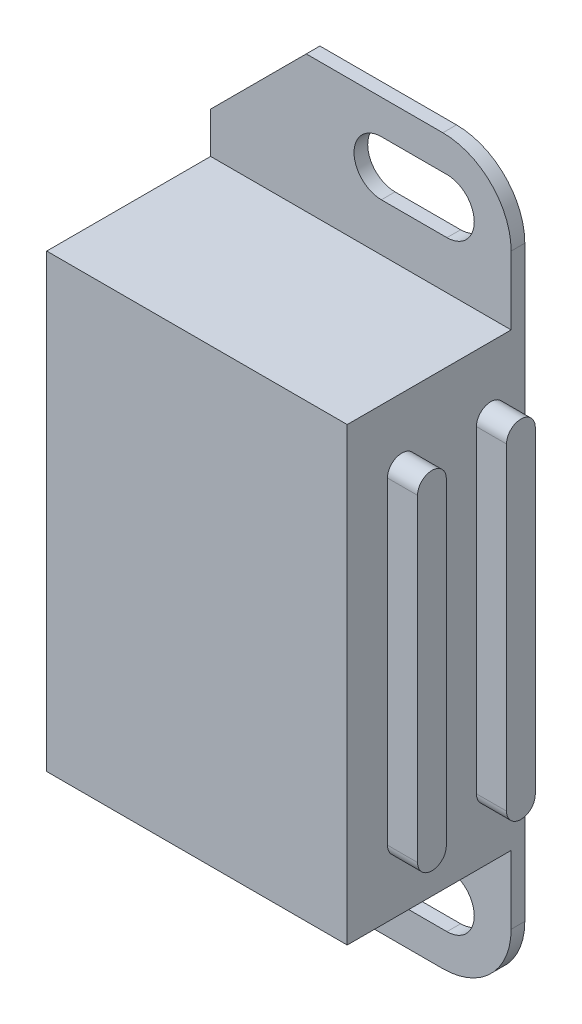
from build123d import *

# Parameters (mm, degrees)
SKETCH_1_W          = 22
SKETCH_1_H          = 53
EXTRUDE_1_DEPTH     = 1
CUT_EXTRUDE_1_DEPTH = 29.70975444
SKETCH_3_W          = 22
SKETCH_3_H          = 33
EXTRUDE_2_DEPTH     = 12
EXTRUDE_3_DEPTH     = 2.2
CHAMFER_1_SIZE      = 7
FILLET_1_R          = 5


with BuildPart() as part:
    # 草图1 → 凸台-拉伸1 (new body)
    with BuildSketch(Plane.XY):
        Rectangle(SKETCH_1_W, SKETCH_1_H)
    extrude(amount=EXTRUDE_1_DEPTH)

    # 草图2 → 切除-拉伸1 (cut, through all)
    with BuildSketch(Plane.XY.offset(1)):
        with BuildLine():
            Line((1.5, 24), (6.3, 24))
            ThreePointArc((6.3, 24), (8.3, 22), (6.3, 20))
            Line((6.3, 20), (1.5, 20))
            ThreePointArc((1.5, 20), (-0.5, 22), (1.5, 24))
        make_face()
    cut_extrude_1 = extrude(amount=-CUT_EXTRUDE_1_DEPTH, mode=Mode.SUBTRACT)

    # 镜向1: 切除-拉伸1 across plane
    add(cut_extrude_1.mirror(Plane.ZX), mode=Mode.SUBTRACT)

    # 草图3 → 凸台-拉伸2 (add)
    with BuildSketch(Plane.XY.offset(1)):
        Rectangle(SKETCH_3_W, SKETCH_3_H)
    extrude(amount=EXTRUDE_2_DEPTH)

    # 草图4 → 凸台-拉伸3 (add)
    with BuildSketch(Plane(origin=(11, 0, 0), x_dir=(0, 0, -1), z_dir=(1, 0, 0))):
        with BuildLine():
            Line((-10.054063842, -11.63862159), (-10.054063842, 11.63862159))
            ThreePointArc((-10.054063842, 11.63862159), (-9, 12.692685432), (-7.945936158, 11.63862159))
            Line((-7.945936158, 11.63862159), (-7.945936158, -11.63862159))
            ThreePointArc((-7.945936158, -11.63862159), (-9, -12.692685432), (-10.054063842, -11.63862159))
        make_face()
        with BuildLine():
            Line((-1.432333752, -11.63862159), (-1.432333752, 11.63862159))
            ThreePointArc((-1.432333752, 11.63862159), (-2.486397594, 12.692685432), (-3.540461436, 11.63862159))
            Line((-3.540461436, 11.63862159), (-3.540461436, -11.63862159))
            ThreePointArc((-3.540461436, -11.63862159), (-2.486397594, -12.692685432), (-1.432333752, -11.63862159))
        make_face()
    extrude(amount=EXTRUDE_3_DEPTH)

    # 倒角1
    chamfer_1_edges = [part.edges().sort_by_distance(p)[0] for p in [
        (-11, -26.5, 0.5),
        (-11, 26.5, 0.5),
    ]]
    chamfer(chamfer_1_edges, length=CHAMFER_1_SIZE)

    # 圆角1
    fillet_1_edges = [part.edges().sort_by_distance(p)[0] for p in [
        (11, -26.5, 0.5),
        (11, 26.5, 0.5),
    ]]
    fillet(fillet_1_edges, radius=FILLET_1_R)


solid = part.part
